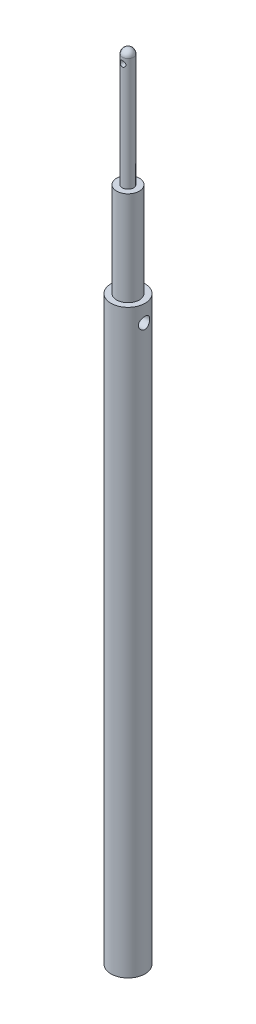
from build123d import *

# Parameters (mm, degrees)
SKETCH1_R               = 9
BOSS_EXTRUDE1_DEPTH     = 308
SKETCH3_R               = 3
CUT_EXTRUDE1_DEPTH      = 100
SKETCH4_R               = 6
BOSS_EXTRUDE2_DEPTH     = 50
SKETCH5_R               = 3
BOSS_EXTRUDE3_DEPTH     = 60
CUT_EXTRUDE4_DEPTH      = 30
CUT_EXTRUDE4_DEPTH_BACK = 40
SKETCH6_R               = 1.5


with BuildPart() as part:
    # Sketch1 → Boss-Extrude1 (new body)
    with BuildSketch(Plane(origin=(0, 0, 0), x_dir=(1, 0, 0), z_dir=(0, 1, 0))):
        with Locations(Location((0, 0, 0), (0, 0, 270))):
            Circle(SKETCH1_R)
    extrude(amount=BOSS_EXTRUDE1_DEPTH)

    # Sketch3 → Cut-Extrude1 (cut, symmetric)
    with BuildSketch(Plane(origin=(0, 0, 0), x_dir=(0, 0, -1), z_dir=(1, 0, 0))):
        with Locations((0, 299)):
            Circle(SKETCH3_R)
    extrude(amount=CUT_EXTRUDE1_DEPTH, both=True, mode=Mode.SUBTRACT)

    # Sketch4 → Boss-Extrude2 (add)
    with BuildSketch(Plane(origin=(0, 308, 0), x_dir=(1, 0, 0), z_dir=(0, 1, 0))):
        with Locations(Location((0, 0, 0), (0, 0, 270))):
            Circle(SKETCH4_R)
    extrude(amount=BOSS_EXTRUDE2_DEPTH)

    # Sketch5 → Boss-Extrude3 (add)
    with BuildSketch(Plane(origin=(0, 358, 0), x_dir=(1, 0, 0), z_dir=(0, 1, 0))):
        with Locations(Location((0, 0, 0), (0, 0, 90))):
            Circle(SKETCH5_R)
    extrude(amount=BOSS_EXTRUDE3_DEPTH)

    # Sketch8 → Revolve1 (revolve)
    with BuildSketch(Plane.XY):
        with BuildLine():
            Line((3, 418), (-3, 418))
            ThreePointArc((-3, 418), (0, 421), (3, 418))
        make_face()
    revolve(axis=Axis((3, 418, 0), (-1, 0, 0)))

    # Sketch6 → Cut-Extrude4 (cut, two sides: drawn at the far end of the back side and taken through both)
    with BuildSketch(Plane.XY.offset(-CUT_EXTRUDE4_DEPTH_BACK)):
        with Locations(Location((0, 415, 0), (0, 0, 89.99999999))):
            Circle(SKETCH6_R)
    extrude(amount=CUT_EXTRUDE4_DEPTH + CUT_EXTRUDE4_DEPTH_BACK, mode=Mode.SUBTRACT)


solid = part.part
